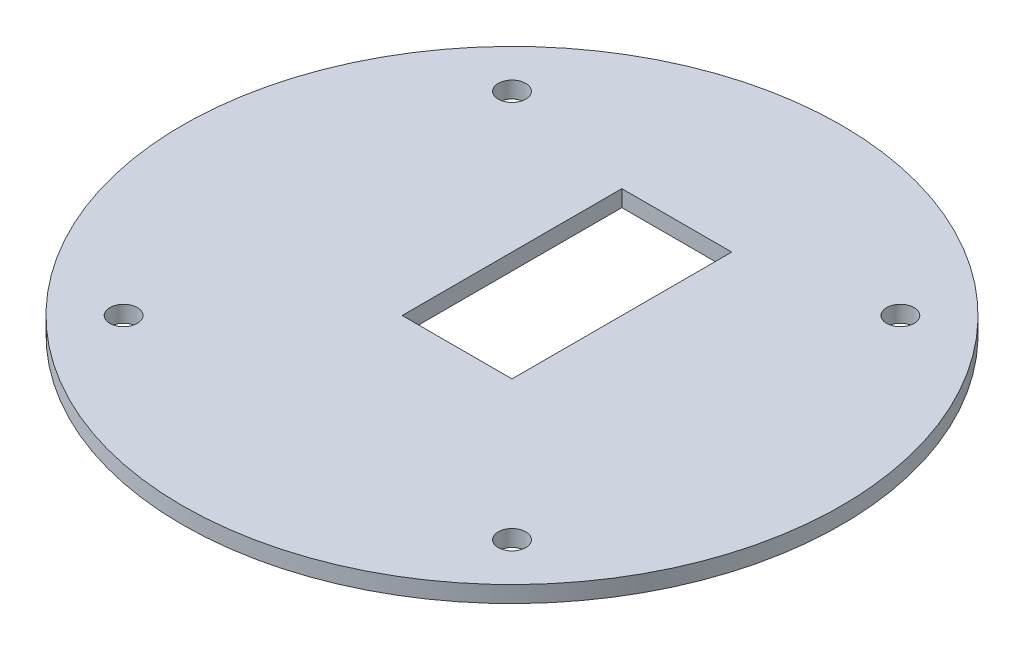
from build123d import *

# Parameters (mm, degrees)
SKETCH_1_R      = 60
SKETCH_1_R_2    = 2.5
SKETCH_1_W      = 20
SKETCH_1_H      = 40
EXTRUDE_1_DEPTH = 3


with BuildPart() as part:
    # 草图1 → 凸台-拉伸1 (new body)
    with BuildSketch(Plane(origin=(0, 0, 0), x_dir=(1, 0, 0), z_dir=(0, 1, 0))):
        with Locations(Location((0, 0, 0), (0, 0, 270))):
            Circle(SKETCH_1_R)
        with Locations(Location((-35.355339059, 35.355339059, 0), (0, 0, 270))):
            Circle(SKETCH_1_R_2, mode=Mode.SUBTRACT)
        with Locations(Location((35.355339059, 35.355339059, 0), (0, 0, 270))):
            Circle(SKETCH_1_R_2, mode=Mode.SUBTRACT)
        with Locations(Location((35.355339059, -35.355339059, 0), (0, 0, 270))):
            Circle(SKETCH_1_R_2, mode=Mode.SUBTRACT)
        with Locations(Location((-35.355339059, -35.355339059, 0), (0, 0, 270))):
            Circle(SKETCH_1_R_2, mode=Mode.SUBTRACT)
        with Locations((0, 10)):
            Rectangle(SKETCH_1_W, SKETCH_1_H, mode=Mode.SUBTRACT)
    extrude(amount=EXTRUDE_1_DEPTH)


solid = part.part
